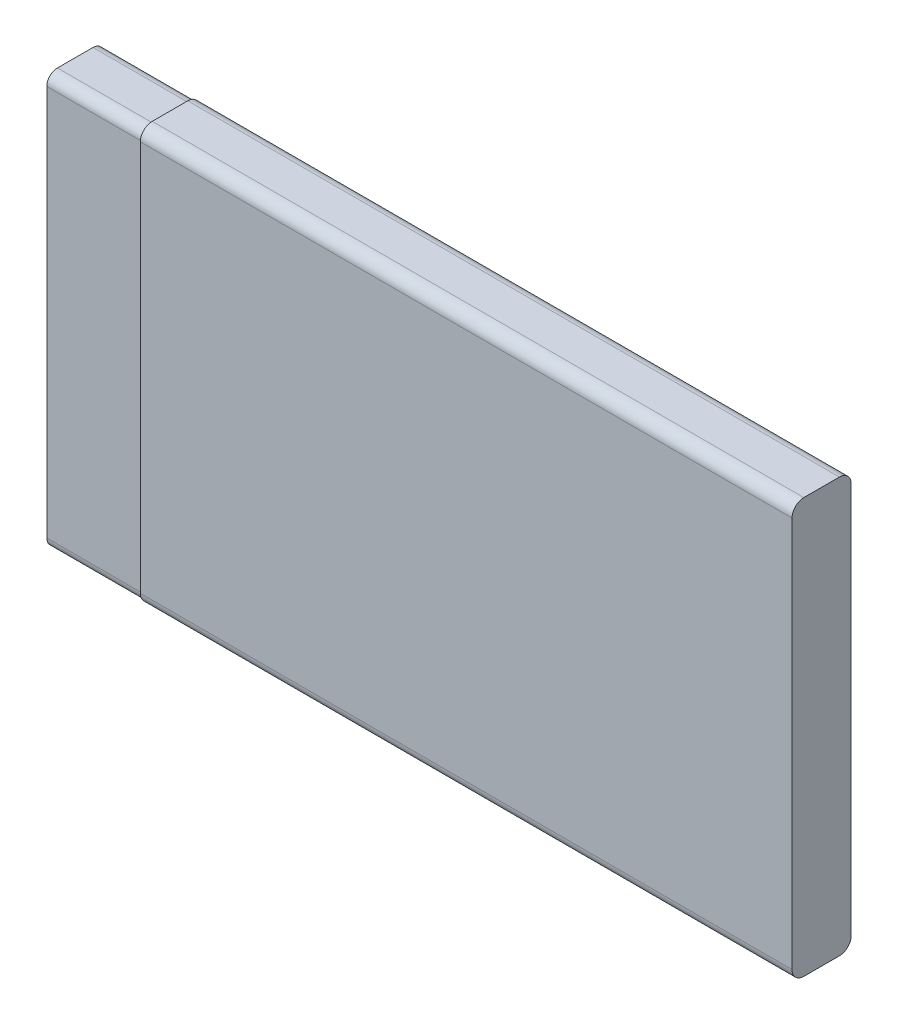
from build123d import *

# Parameters (mm, degrees)
SKETCH1_W           = 55
SKETCH1_H           = 35
BOSS_EXTRUDE1_DEPTH = 2.5
FILLET1_R           = 1
SKETCH2_W           = 5.5
SKETCH2_H           = 33
BOSS_EXTRUDE2_DEPTH = 0.8
BOSS_EXTRUDE4_DEPTH = 8


with BuildPart() as part:
    # Sketch1 → Boss-Extrude1 (new, symmetric)
    with BuildSketch(Plane.XY):
        with Locations((4, 0)):
            Rectangle(SKETCH1_W, SKETCH1_H)
    extrude(amount=BOSS_EXTRUDE1_DEPTH, both=True)

    # Fillet1
    fillet1_edges = [part.edges().sort_by_distance(p)[0] for p in [
        (4, 17.5, 2.5),
        (4, -17.5, 2.5),
        (4, 17.5, -2.5),
        (4, -17.5, -2.5),
    ]]
    fillet(fillet1_edges, radius=FILLET1_R)

    # Sketch2 → Boss-Extrude2 (add, symmetric)
    with BuildSketch(Plane.XY):
        with Locations((-26.25, 0)):
            Rectangle(SKETCH2_W, SKETCH2_H)
    extrude(amount=BOSS_EXTRUDE2_DEPTH, both=True)

    # Sketch3 → Boss-Extrude4 (add)
    with BuildSketch(Plane.ZY.offset(23.5)):
        with BuildLine():
            Line((-1.5, -17.4), (1.5, -17.4))
            ThreePointArc((1.5, -17.4), (2.136396103, -17.136396103), (2.4, -16.5))
            Line((2.4, -16.5), (2.4, 16.5))
            ThreePointArc((2.4, 16.5), (2.136396103, 17.136396103), (1.5, 17.4))
            Line((1.5, 17.4), (-1.5, 17.4))
            ThreePointArc((-1.5, 17.4), (-2.136396103, 17.136396103), (-2.4, 16.5))
            Line((-2.4, 16.5), (-2.4, -16.5))
            ThreePointArc((-2.4, -16.5), (-2.136396103, -17.136396103), (-1.5, -17.4))
        make_face()
        with BuildLine():
            Line((-1.5, -17.3), (1.5, -17.3))
            ThreePointArc((1.5, -17.3), (2.065685425, -17.065685425), (2.3, -16.5))
            Line((2.3, -16.5), (2.3, 16.5))
            ThreePointArc((2.3, 16.5), (2.065685425, 17.065685425), (1.5, 17.3))
            Line((1.5, 17.3), (-1.5, 17.3))
            ThreePointArc((-1.5, 17.3), (-2.065685425, 17.065685425), (-2.3, 16.5))
            Line((-2.3, 16.5), (-2.3, -16.5))
            ThreePointArc((-2.3, -16.5), (-2.065685425, -17.065685425), (-1.5, -17.3))
        make_face(mode=Mode.SUBTRACT)
    extrude(amount=BOSS_EXTRUDE4_DEPTH)


solid = part.part
